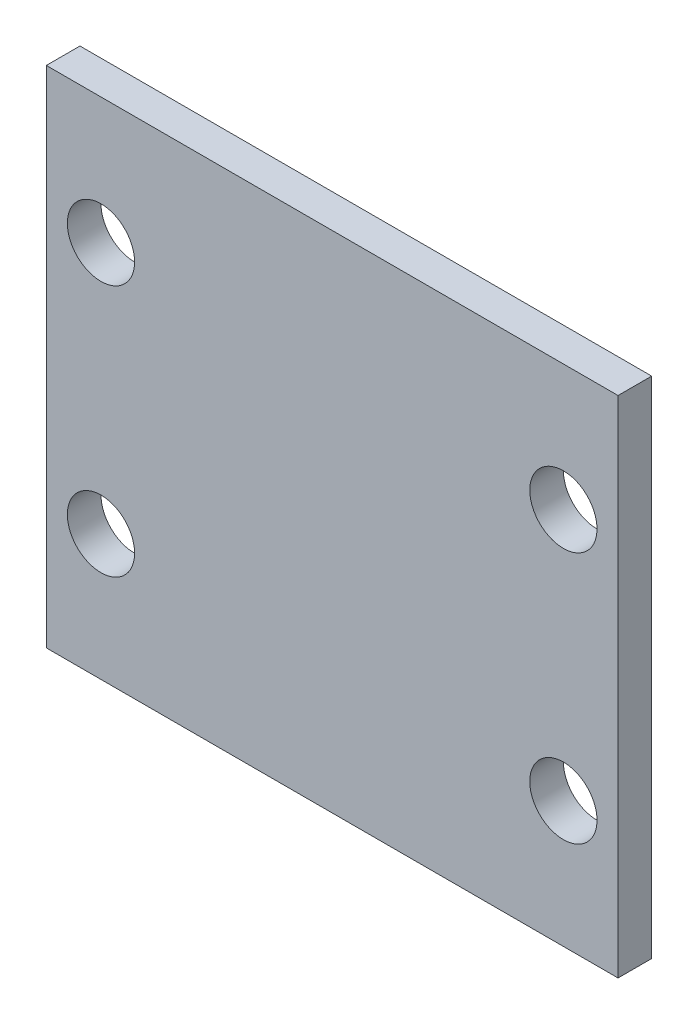
from build123d import *

# Parameters (mm, degrees)
SKETCH1_W           = 43.17991364
SKETCH1_H           = 38.0999238
SKETCH1_R           = 2.54
SKETCH1_R_2         = 2.53999492
BOSS_EXTRUDE1_DEPTH = 2.54


with BuildPart() as part:
    # Sketch1 → Boss-Extrude1 (new body)
    with BuildSketch(Plane.XY):
        Rectangle(SKETCH1_W, SKETCH1_H)
        with Locations((-17.46254572, 9.52481966)):
            Circle(SKETCH1_R, mode=Mode.SUBTRACT)
        with Locations((-17.46254572, -9.52546482)):
            Circle(SKETCH1_R_2, mode=Mode.SUBTRACT)
        with Locations((17.46254572, -9.52546482)):
            Circle(SKETCH1_R_2, mode=Mode.SUBTRACT)
        with Locations((17.46254572, 9.52481966)):
            Circle(SKETCH1_R, mode=Mode.SUBTRACT)
    extrude(amount=BOSS_EXTRUDE1_DEPTH)


solid = part.part
